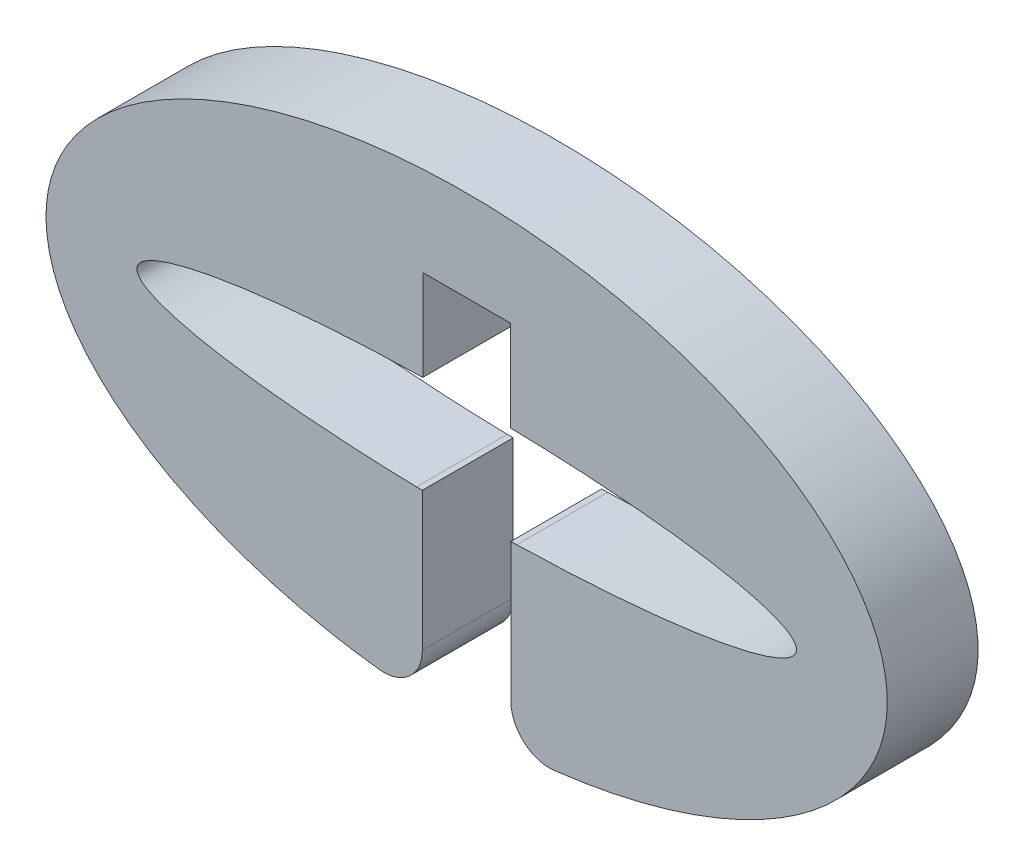
from build123d import *

# Parameters (mm, degrees)
EXTRUDE_1_DEPTH     = 3
SKETCH_2_W          = 2.925
SKETCH_2_H          = 10.758739034
CUT_EXTRUDE_1_DEPTH = 3
FILLET_1_R          = 1.27


with BuildPart() as part:
    # 스케치1 → 보스-돌출1 (new body)
    with BuildSketch(Plane.XY):
        with BuildLine():
            ThreePointArc((-1.657662177, -7.565589976), (0, -7.61746494), (1.657662177, -7.565589976))
            add(Edge.make_bspline(
                [(1.657662177, -7.565589976), (23.496062709, -6.126815969), (11.748031355, 4.069931226), (0, 14.266678421), (-11.748031355, 4.069931226), (-23.496062709, -6.126815969), (-1.657662177, -7.565589976)],
                knots=[1.690370044, 1.690370044, 1.690370044, 3.705049335, 3.705049335, 5.719728626, 5.719728626, 7.734407917, 7.734407917, 7.734407917], degree=2, weights=[1, 0.534111709, 1, 0.534111709, 1, 0.534111709, 1]))
        make_face()
        with BuildLine():
            Line((-1.4475, 1.62), (-1.4475, 4.62))
            Line((-1.4475, 4.62), (1.4475, 4.62))
            Line((1.4475, 4.62), (1.4475, 1.62))
            add(Edge.make_bspline(
                [(1.657662177, -1.61546146), (10.987646704, -1.400037569), (10.895671624, 0.015925235), (10.803696545, 1.431888039), (1.4475, 1.62)],
                knots=[1.723521647, 1.723521647, 1.723521647, 3.151336072, 3.151336072, 4.579150497, 4.579150497, 4.579150497], degree=2, weights=[1, 0.755809241, 1, 0.755809241, 1]))
            Line((1.657662177, -1.61546146), (-1.657662177, -1.61546146))
            add(Edge.make_bspline(
                [(-1.4475, 1.62), (-10.803696545, 1.431888039), (-10.895671624, 0.015925235), (-10.987646704, -1.400037569), (-1.657662177, -1.61546146)],
                knots=[4.845627464, 4.845627464, 4.845627464, 6.273441889, 6.273441889, 7.701256314, 7.701256314, 7.701256314], degree=2, weights=[1, 0.755809241, 1, 0.755809241, 1]))
        make_face(mode=Mode.SUBTRACT)
    extrude(amount=EXTRUDE_1_DEPTH)

    # 스케치2 → 컷-돌출1 (cut)
    with BuildSketch(Plane.XY.offset(3)):
        with Locations((0, -6.229717836)):
            Rectangle(SKETCH_2_W, SKETCH_2_H)
    extrude(amount=-CUT_EXTRUDE_1_DEPTH, mode=Mode.SUBTRACT)

    # 필렛1
    fillet_1_edges = [part.edges().sort_by_distance(p)[0] for p in [
        (-1.4625, -7.577094528, 1.5),
        (1.4625, -7.577094528, 1.5),
    ]]
    fillet(fillet_1_edges, radius=FILLET_1_R)


solid = part.part
